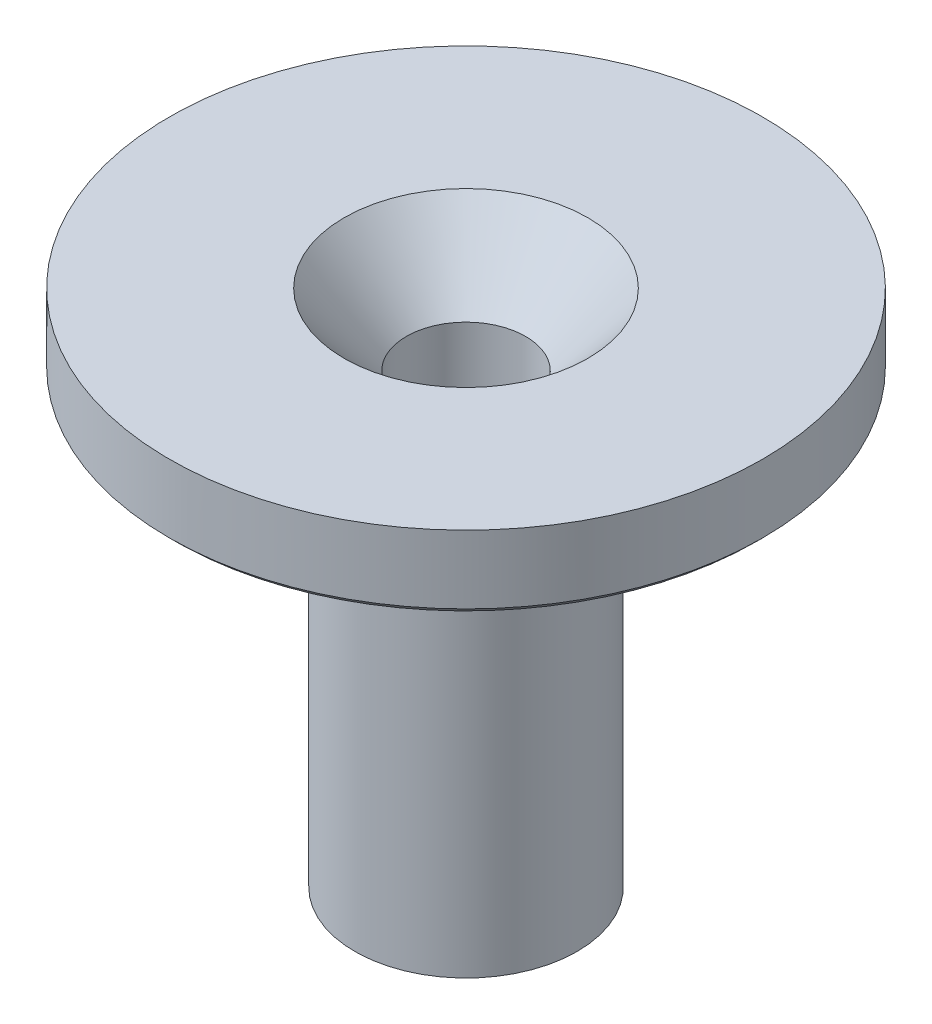
from build123d import *

# Parameters (mm, degrees)
CSK_FOR_10_FLAT_HEAD_SOCKET_CAP_SCREW1_D           = 5.1054
CSK_FOR_10_FLAT_HEAD_SOCKET_CAP_SCREW1_CSINK_D     = 10.4394
CSK_FOR_10_FLAT_HEAD_SOCKET_CAP_SCREW1_CSINK_ANGLE = 82
CHAMFER1_SIZE                                      = 0.254


with BuildPart() as part:
    # Sketch2 → Revolve1 (revolve)
    with BuildSketch(Plane.XY, mode=Mode.PRIVATE) as revolve1_sk:
        Polygon((0, 10.140493615), (-12.7, 10.140493615), (-12.7, 6.965493615), (-4.7625, 6.965493615), (-4.7625, -12.084506385), (0, -12.084506385), align=None)
    revolve(revolve1_sk.sketch.rotate(Axis((0, -12.084506385, 0), (0, 1, 0)), 180), axis=Axis((0, -12.084506385, 0), (0, 1, 0)))

    # CSK for #10 Flat Head Socket Cap Screw1 (through all)
    with Locations(Plane(origin=(0, 10.140493615, 0), x_dir=(1, 0, 0), z_dir=(0, 1, 0))):
        with Locations((0, 0)):
            CounterSinkHole(CSK_FOR_10_FLAT_HEAD_SOCKET_CAP_SCREW1_D / 2, CSK_FOR_10_FLAT_HEAD_SOCKET_CAP_SCREW1_CSINK_D / 2, counter_sink_angle=CSK_FOR_10_FLAT_HEAD_SOCKET_CAP_SCREW1_CSINK_ANGLE)

    # Chamfer1
    chamfer1_edges = [part.edges().sort_by_distance(p)[0] for p in [
        (-12.7, 6.965493615, 0),
    ]]
    chamfer(chamfer1_edges, length=CHAMFER1_SIZE)


solid = part.part
